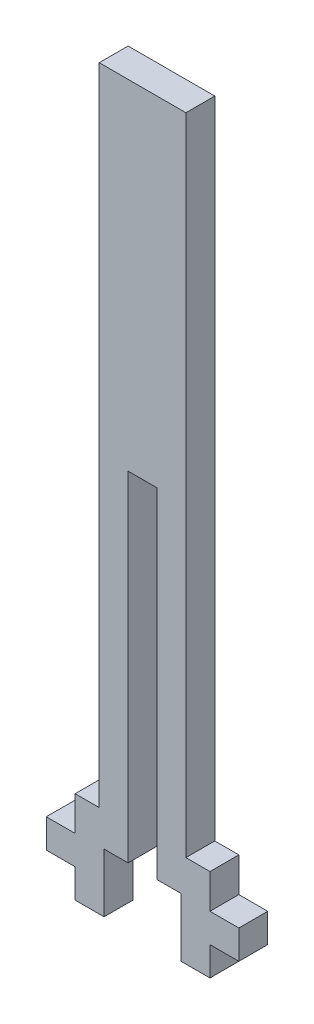
from build123d import *

# Parameters (mm, degrees)
EXTRUDE_1_DEPTH     = 3
SKETCH_2_W          = 3
SKETCH_2_H          = 35.231500037
CUT_EXTRUDE_1_DEPTH = 3
SKETCH_3_W          = 3
SKETCH_3_H          = 3
EXTRUDE_2_DEPTH     = 3


with BuildPart() as part:
    # 스케치1 → 보스-돌출1 (new body)
    with BuildSketch(Plane.XY):
        Polygon((-4.5, 38.281500037), (4.5, 38.281500037), (4.5, -28.706499941), (7, -28.706499941), (7, -38.281500037), (4, -38.281500037), (4, -32.181500037), (-4, -32.181500037), (-4, -38.281500037), (-7, -38.281500037), (-7, -28.706499941), (-4.5, -28.706499941), align=None)
    extrude(amount=EXTRUDE_1_DEPTH)

    # 스케치2 → 컷-돌출1 (cut)
    with BuildSketch(Plane(origin=(0, 0, 0), x_dir=(-1, 0, 0), z_dir=(0, 0, -1))):
        with Locations((0, -14.565750018)):
            Rectangle(SKETCH_2_W, SKETCH_2_H)
    extrude(amount=-CUT_EXTRUDE_1_DEPTH, mode=Mode.SUBTRACT)

    # 스케치3 → 보스-돌출2 (add)
    with BuildSketch(Plane.XY.offset(3)):
        with Locations((-8.5, -33.781500037)):
            Rectangle(SKETCH_3_W, SKETCH_3_H)
        with Locations((8.5, -33.781500037)):
            Rectangle(SKETCH_3_W, SKETCH_3_H)
    extrude(amount=-EXTRUDE_2_DEPTH)


solid = part.part
